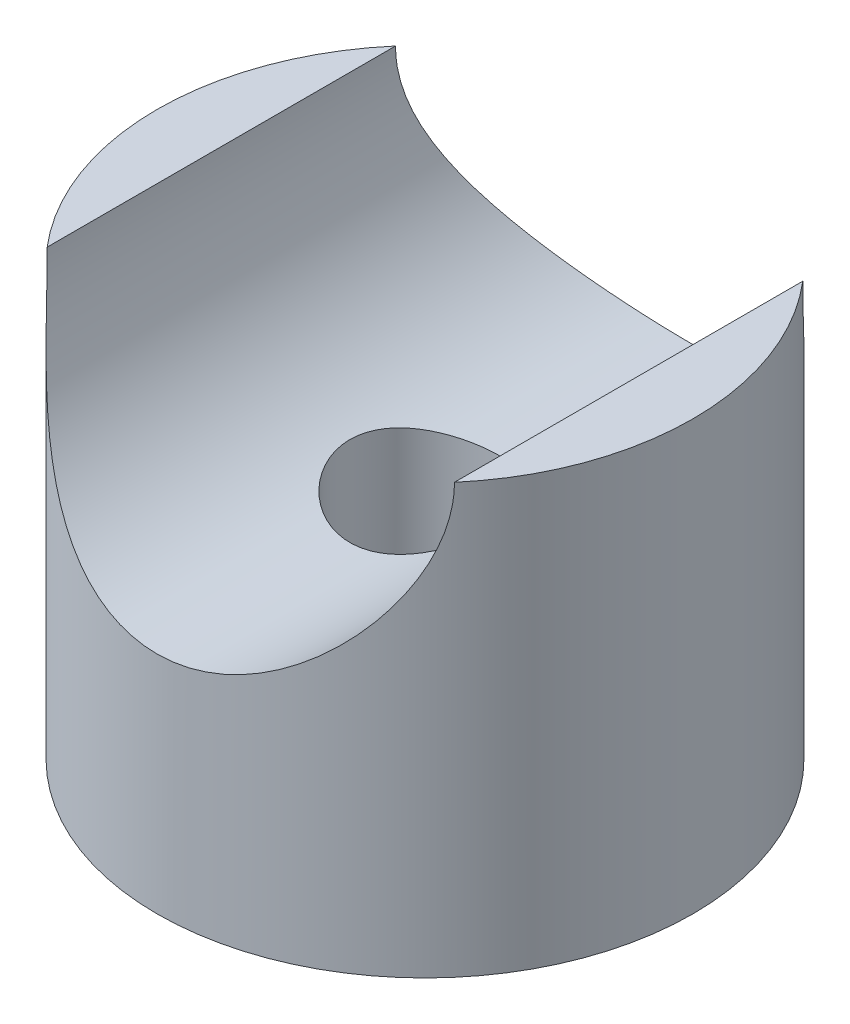
from build123d import *

# Parameters (mm, degrees)
SKETCH1_R               = 12.5
SKETCH1_R_2             = 3.5
BOSS_EXTRUDE1_DEPTH     = 20
CUT_EXTRUDE1_DEPTH      = 22
CUT_EXTRUDE1_DEPTH_BACK = 22
SKETCH2_R               = 9.5


with BuildPart() as part:
    # Sketch1 → Boss-Extrude1 (new body)
    with BuildSketch(Plane(origin=(0, 0, 0), x_dir=(1, 0, 0), z_dir=(0, 1, 0))):
        Circle(SKETCH1_R)
        Circle(SKETCH1_R_2, mode=Mode.SUBTRACT)
    extrude(amount=BOSS_EXTRUDE1_DEPTH)

    # Sketch2 → Cut-Extrude1 (cut, two sides: drawn at the far end of the back side and taken through both)
    with BuildSketch(Plane.XY.offset(-CUT_EXTRUDE1_DEPTH_BACK)):
        with Locations((0, 20)):
            Circle(SKETCH2_R)
    extrude(amount=CUT_EXTRUDE1_DEPTH + CUT_EXTRUDE1_DEPTH_BACK, mode=Mode.SUBTRACT)


solid = part.part
